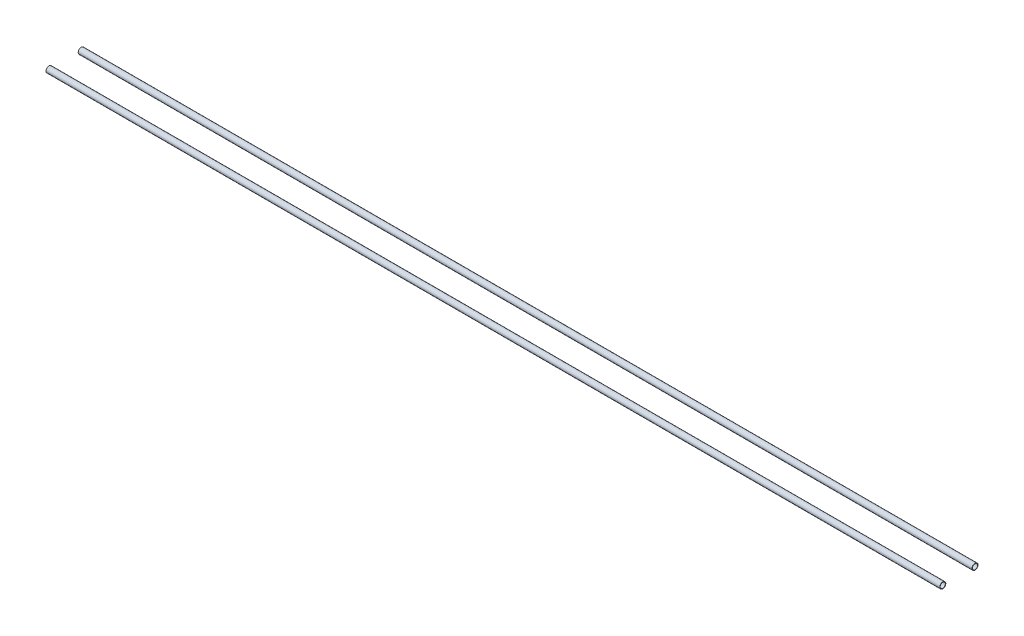
from build123d import *

# Parameters (mm, degrees)
SKETCH2_R             = 7
SKETCH2_R_2           = 6
BOSS_EXTRUDE1_DEPTH   = 1040
BOSS_EXTRUDE1_2_DEPTH = 1040


with BuildPart() as part:
    # Sketch2 → Boss-Extrude1 (new, symmetric)
    with BuildSketch(Plane(origin=(0, 0, 0), x_dir=(0, 0, -1), z_dir=(1, 0, 0))):
        Circle(SKETCH2_R)
        Circle(SKETCH2_R_2, mode=Mode.SUBTRACT)
    extrude(amount=BOSS_EXTRUDE1_DEPTH, both=True)


with BuildPart() as body_2:
    # Sketch2 → Boss-Extrude1 2 (new, symmetric)
    with BuildSketch(Plane(origin=(0, 0, 0), x_dir=(0, 0, -1), z_dir=(1, 0, 0))):
        with Locations((75, 0)):
            Circle(SKETCH2_R)
        with Locations((75, 0)):
            Circle(SKETCH2_R_2, mode=Mode.SUBTRACT)
    extrude(amount=BOSS_EXTRUDE1_2_DEPTH, both=True)


solid = Compound([part.part, body_2.part])
